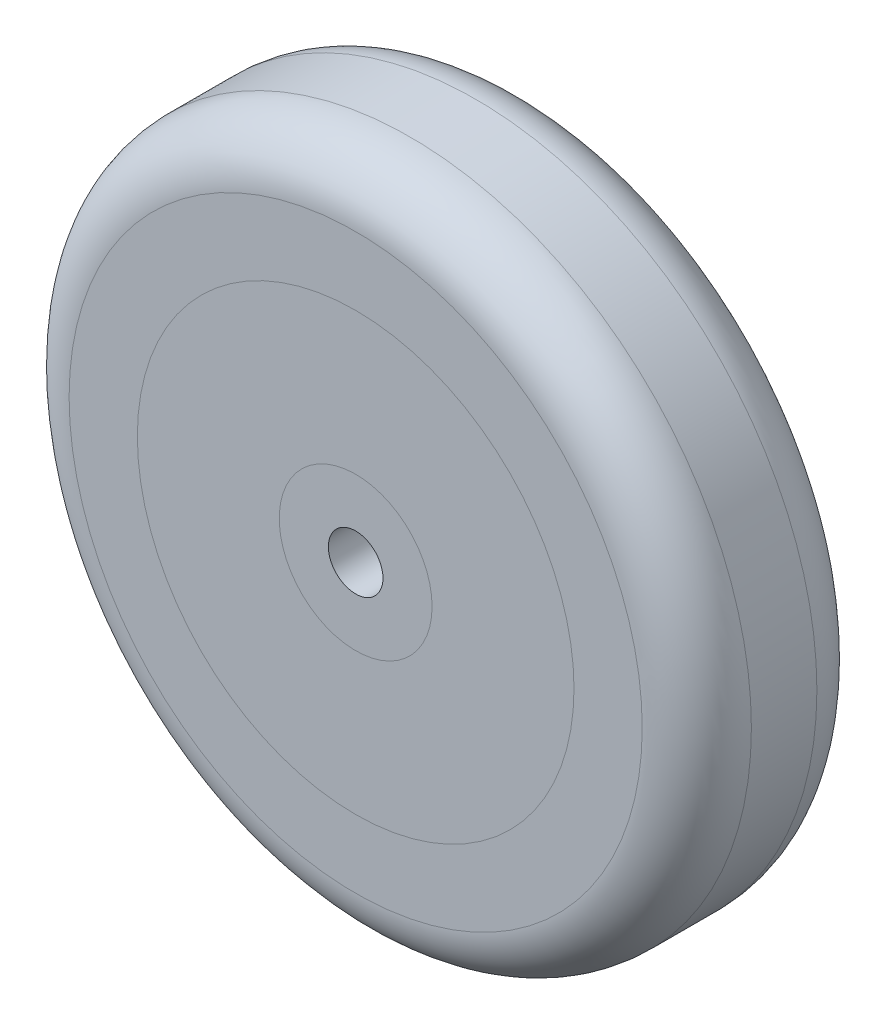
from build123d import *

# Parameters (mm, degrees)
SKETCH1_R           = 40
SKETCH1_R_2         = 14
BOSS_EXTRUDE1_DEPTH = 32
SKETCH2_R           = 62.5
SKETCH2_R_2         = 40
BOSS_EXTRUDE2_DEPTH = 32
SKETCH3_R           = 14
SKETCH3_R_2         = 5
BOSS_EXTRUDE3_DEPTH = 32
FILLET1_R           = 10


with BuildPart() as part:
    # Sketch1 → Boss-Extrude1 (new body)
    with BuildSketch(Plane.XY):
        Circle(SKETCH1_R)
        Circle(SKETCH1_R_2, mode=Mode.SUBTRACT)
    extrude(amount=BOSS_EXTRUDE1_DEPTH)


with BuildPart() as body_2:
    # Sketch2 → Boss-Extrude2 (new body)
    with BuildSketch(Plane.XY.offset(32)):
        Circle(SKETCH2_R)
        Circle(SKETCH2_R_2, mode=Mode.SUBTRACT)
    extrude(amount=-BOSS_EXTRUDE2_DEPTH)

    # Fillet1
    fillet1_edges = [body_2.edges().sort_by_distance(p)[0] for p in [
        (-62.5, 0, 32),
        (-62.5, 0, 0),
    ]]
    fillet(fillet1_edges, radius=FILLET1_R)


with BuildPart() as body_3:
    # Sketch3 → Boss-Extrude3 (new body)
    with BuildSketch(Plane.XY.offset(32)):
        Circle(SKETCH3_R)
        Circle(SKETCH3_R_2, mode=Mode.SUBTRACT)
    extrude(amount=-BOSS_EXTRUDE3_DEPTH)


solid = Compound([part.part, body_2.part, body_3.part])
